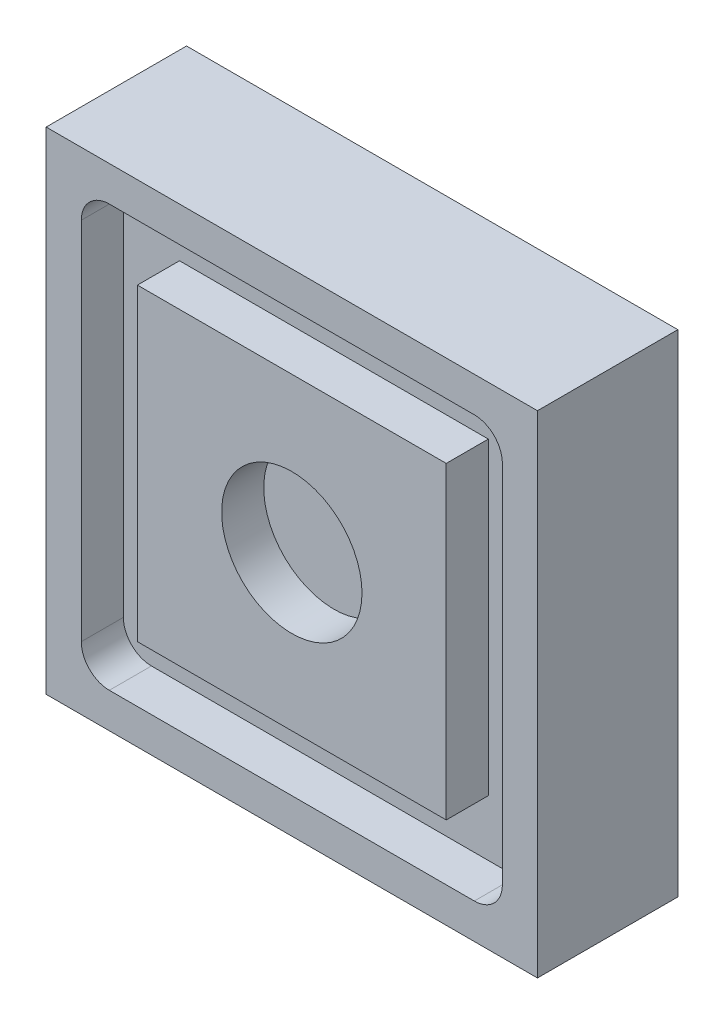
from build123d import *

# Parameters (mm, degrees)
ESQUISSE2_W                     = 35
ESQUISSE2_H                     = 35
BOSS_EXTRU_2_DEPTH              = 10
ESQUISSE3_W                     = 22
ESQUISSE3_H                     = 22
ENL_V_DE_MAT_EXTRU_MINCE1_DEPTH = 3
ESQUISSE4_R                     = 5
ENL_V_MAT_EXTRU_1_DEPTH         = 3


with BuildPart() as part:
    # Esquisse2 → Boss.-Extru.2 (new body)
    with BuildSketch(Plane.XY):
        Rectangle(ESQUISSE2_W, ESQUISSE2_H)
    extrude(amount=BOSS_EXTRU_2_DEPTH)

    # Esquisse3 → Enlèv. de mat.-Extru.-Mince1 (cut)
    with BuildSketch(Plane.XY.offset(10)):
        with BuildLine():
            Line((-13, 15), (13, 15))
            ThreePointArc((13, 15), (14.414213562, 14.414213562), (15, 13))
            Line((15, 13), (15, -13))
            ThreePointArc((15, -13), (14.414213562, -14.414213562), (13, -15))
            Line((13, -15), (-13, -15))
            ThreePointArc((-13, -15), (-14.414213562, -14.414213562), (-15, -13))
            Line((-15, -13), (-15, 13))
            ThreePointArc((-15, 13), (-14.414213562, 14.414213562), (-13, 15))
        make_face()
        Rectangle(ESQUISSE3_W, ESQUISSE3_H, mode=Mode.SUBTRACT)
    extrude(amount=-ENL_V_DE_MAT_EXTRU_MINCE1_DEPTH, mode=Mode.SUBTRACT)

    # Esquisse4 → Enlèv. mat.-Extru.1 (cut)
    with BuildSketch(Plane.XY.offset(10)):
        Circle(ESQUISSE4_R)
    extrude(amount=-ENL_V_MAT_EXTRU_1_DEPTH, mode=Mode.SUBTRACT)


solid = part.part
